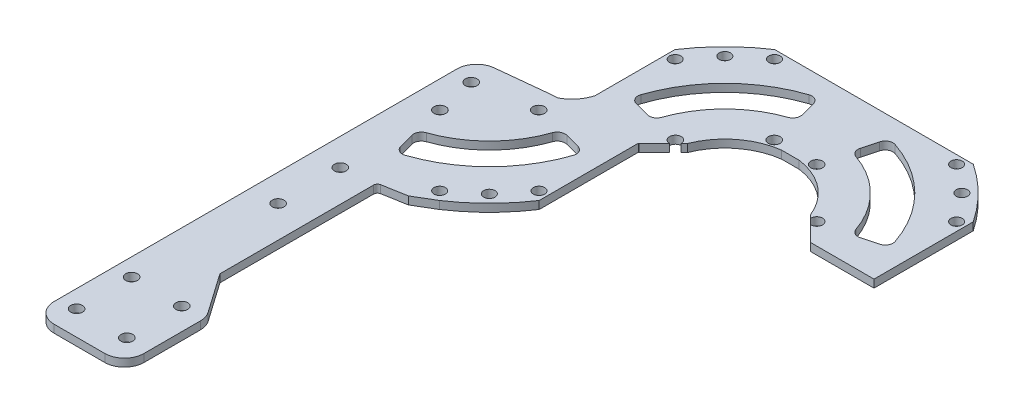
from build123d import *

# Parameters (mm, degrees)
SKETCH1_R           = 1.5
SKETCH1_R_2         = 1.45
BOSS_EXTRUDE1_DEPTH = 2
SKETCH_1_R          = 1.45
SKETCH_1_R_2        = 1.5
EXTRUDE_1_DEPTH     = 2
EXTRUDE_2_DEPTH     = 2
FILLET1_R           = 1


with BuildPart() as part:
    # Sketch1 → Boss-Extrude1 (new body)
    with BuildSketch(Plane(origin=(0, 0, 0), x_dir=(1, 0, 0), z_dir=(0, 1, 0))):
        with BuildLine():
            Line((-21.192961085, -132.078714637), (-21.192961085, -166.219718768))
            Line((-21.192961085, -166.219718768), (-14.185358568, -176.236618152))
            ThreePointArc((-14.185358568, -176.236618152), (-13.513427934, -177.60024794), (-13.282330236, -179.10276943))
            Line((-13.282330236, -179.10276943), (-13.282330236, -193.470906367))
            ThreePointArc((-13.282330236, -193.470906367), (-14.74679633, -197.006440273), (-18.282330236, -198.470906367))
            Line((-18.282330236, -198.470906367), (-21.77517331, -198.470906367))
            Line((-21.77517331, -198.470906367), (-31.192961085, -198.470906367))
            ThreePointArc((-31.192961085, -198.470906367), (-34.728494991, -197.006440273), (-36.192961085, -193.470906367))
            Line((-36.192961085, -193.470906367), (-36.192961085, -90.830339434))
            ThreePointArc((-36.192961085, -90.830339434), (-34.909297601, -87.485366654), (-31.717423925, -85.857921639))
            Line((-31.717423925, -85.857921639), (-19.324348326, -84.550769285))
            Line((-19.324348326, -84.550769285), (-12.49642386, -84.082177413))
            Line((-12.49642386, -84.082177413), (3.10357614, -84.082177413))
            Line((3.10357614, -84.082177413), (3.307038915, -84.078714637))
            Line((3.307038915, -84.078714637), (3.307038915, -109.367146032))
            ThreePointArc((3.307038915, -109.367146032), (-2.41677201, -116.354903712), (-9.40452969, -122.078714637))
            Line((-9.40452969, -122.078714637), (-14.349438262, -125.02189202))
            Line((-14.349438262, -125.02189202), (-21.192961085, -126.237284003))
            Line((-21.192961085, -126.237284003), (-21.192961085, -132.078714637))
        make_face()
        with Locations(Location((-18.919157596, -192.204354167, 0), (0, 0, 270))):
            Circle(SKETCH1_R, mode=Mode.SUBTRACT)
        with Locations(Location((-18.919157596, -178.204354167, 0), (0, 0, 270))):
            Circle(SKETCH1_R, mode=Mode.SUBTRACT)
        with Locations(Location((-31.717423925, -178.204354167, 0), (0, 0, 270))):
            Circle(SKETCH1_R, mode=Mode.SUBTRACT)
        with Locations(Location((-31.717423925, -192.204354167, 0), (0, 0, 270))):
            Circle(SKETCH1_R, mode=Mode.SUBTRACT)
        with Locations(Location((-29.287619577, -102.069022085, 0), (0, 0, 270))):
            Circle(SKETCH1_R, mode=Mode.SUBTRACT)
        with Locations(Location((-16.702653636, -89.484056145, 0), (0, 0, 270))):
            Circle(SKETCH1_R, mode=Mode.SUBTRACT)
        with Locations(Location((1.158345759, -107.272976806, 0), (0, 0, 270))):
            Circle(SKETCH1_R_2, mode=Mode.SUBTRACT)
        with Locations(Location((-4.499501528, -114.272174194, 0), (0, 0, 270))):
            Circle(SKETCH1_R_2, mode=Mode.SUBTRACT)
        with Locations(Location((-11.498698916, -119.930021481, 0), (0, 0, 270))):
            Circle(SKETCH1_R_2, mode=Mode.SUBTRACT)
        with Locations(Location((-29.287619577, -127.462503818, 0), (0, 0, 270))):
            Circle(SKETCH1_R, mode=Mode.SUBTRACT)
        with Locations(Location((-29.287619577, -143.302559608, 0), (0, 0, 270))):
            Circle(SKETCH1_R, mode=Mode.SUBTRACT)
        with Locations(Location((-31.442028499, -91.953708305, 0), (0, 0, 270))):
            Circle(SKETCH1_R, mode=Mode.SUBTRACT)
        with BuildLine():
            Line((-3.683855698, -92.504640443), (-7.556212498, -91.467045565))
            ThreePointArc((-7.556212498, -91.467045565), (-9.011313317, -91.632215687), (-9.963793597, -92.744591918))
            ThreePointArc((-9.963793597, -92.744591918), (-16.148276393, -102.623399329), (-26.027083804, -108.807882125))
            ThreePointArc((-26.027083804, -108.807882125), (-27.139460035, -109.760362404), (-27.304630157, -111.215463223))
            Line((-27.304630157, -111.215463223), (-26.267035279, -115.087820024))
            ThreePointArc((-26.267035279, -115.087820024), (-25.280541686, -116.332651264), (-23.697816809, -116.465904366))
            ThreePointArc((-23.697816809, -116.465904366), (-10.491422144, -108.280253578), (-2.305771356, -95.073858913))
            ThreePointArc((-2.305771356, -95.073858913), (-2.439024458, -93.491134036), (-3.683855698, -92.504640443))
        make_face(mode=Mode.SUBTRACT)
    extrude(amount=BOSS_EXTRUDE1_DEPTH)

    # 草图1 → 凸台-拉伸1 (add)
    with BuildSketch(Plane.XZ):
        with BuildLine():
            Line((-12.69642386, 84.082177413), (-12.69642386, 58.793746018))
            ThreePointArc((-12.69642386, 58.793746018), (-6.972612935, 51.805988338), (0.015144745, 46.082177413))
            Line((0.015144745, 46.082177413), (25.30357614, 46.082177413))
            Line((25.30357614, 46.082177413), (50.592007535, 46.082177413))
            ThreePointArc((50.592007535, 46.082177413), (57.579765215, 51.805988338), (63.30357614, 58.793746018))
            Line((63.30357614, 58.793746018), (63.30357614, 84.078714637))
            Line((63.30357614, 84.078714637), (47.168942899, 84.078714637))
            Line((47.168942899, 84.078714637), (43.263289357, 80.173061094))
            ThreePointArc((43.263289357, 80.173061094), (44.35454376, 77.612712957), (41.794195623, 78.70396736))
            Line((41.794195623, 78.70396736), (40.962688124, 77.872459862))
            ThreePointArc((40.962688124, 77.872459862), (37.21418877, 72.168102006), (31.509830915, 68.419602653))
            ThreePointArc((31.509830915, 68.419602653), (29.563736563, 67.782199069), (27.554675458, 67.385664037))
            Line((27.554675458, 67.385664037), (23.052476821, 67.389126813))
            ThreePointArc((23.052476821, 67.389126813), (21.043415716, 67.785661845), (19.097321364, 68.423065428))
            ThreePointArc((19.097321364, 68.423065428), (13.392963509, 72.171564782), (9.644464155, 77.875922638))
            Line((9.644464155, 77.875922638), (8.812956657, 78.707430136))
            ThreePointArc((8.812956657, 78.707430136), (6.25260852, 77.616175733), (7.343862923, 80.17652387))
            Line((7.343862923, 80.17652387), (3.43820938, 84.082177413))
            Line((3.43820938, 84.082177413), (-12.69642386, 84.082177413))
        make_face()
        with Locations(Location((61.154882984, 60.887915244, 0), (0, 0, 90))):
            Circle(SKETCH_1_R, mode=Mode.SUBTRACT)
        with Locations(Location((55.497035696, 53.888717856, 0), (0, 0, 90))):
            Circle(SKETCH_1_R, mode=Mode.SUBTRACT)
        with Locations(Location((48.497838309, 48.230870569, 0), (0, 0, 90))):
            Circle(SKETCH_1_R, mode=Mode.SUBTRACT)
        with Locations(Location((30.708917648, 66.091869964, 0), (0, 0, 90))):
            Circle(SKETCH_1_R_2, mode=Mode.SUBTRACT)
        with Locations(Location((2.109313971, 48.230870569, 0), (0, 0, 90))):
            Circle(SKETCH_1_R, mode=Mode.SUBTRACT)
        with Locations(Location((-4.889883417, 53.888717856, 0), (0, 0, 90))):
            Circle(SKETCH_1_R, mode=Mode.SUBTRACT)
        with Locations(Location((-10.547730705, 60.887915244, 0), (0, 0, 90))):
            Circle(SKETCH_1_R, mode=Mode.SUBTRACT)
        with Locations(Location((19.898234632, 66.091869964, 0), (0, 0, 90))):
            Circle(SKETCH_1_R_2, mode=Mode.SUBTRACT)
        with BuildLine():
            Line((52.440324726, 76.693846485), (56.312681527, 75.656251607))
            ThreePointArc((56.312681527, 75.656251607), (57.557512766, 74.669758014), (57.690765869, 73.087033137))
            ThreePointArc((57.690765869, 73.087033137), (49.505115081, 59.880638472), (36.298720415, 51.694987684))
            ThreePointArc((36.298720415, 51.694987684), (34.715995538, 51.828240786), (33.729501945, 53.073072026))
            Line((33.729501945, 53.073072026), (32.691907068, 56.945428827))
            ThreePointArc((32.691907068, 56.945428827), (32.857077189, 58.400529646), (33.96945342, 59.353009925))
            ThreePointArc((33.96945342, 59.353009925), (43.848260831, 65.537492721), (50.032743627, 75.416300132))
            ThreePointArc((50.032743627, 75.416300132), (50.985223907, 76.528676363), (52.440324726, 76.693846485))
        make_face(mode=Mode.SUBTRACT)
        with BuildLine():
            Line((17.915245212, 56.945428827), (16.877650334, 53.073072026))
            ThreePointArc((16.877650334, 53.073072026), (15.891156741, 51.828240786), (14.308431864, 51.694987684))
            ThreePointArc((14.308431864, 51.694987684), (1.102037199, 59.880638472), (-7.083613589, 73.087033137))
            ThreePointArc((-7.083613589, 73.087033137), (-6.950360487, 74.669758014), (-5.705529247, 75.656251607))
            Line((-5.705529247, 75.656251607), (-1.833172447, 76.693846485))
            ThreePointArc((-1.833172447, 76.693846485), (-0.378071628, 76.528676363), (0.574408652, 75.416300132))
            ThreePointArc((0.574408652, 75.416300132), (6.758891448, 65.537492721), (16.637698859, 59.353009925))
            ThreePointArc((16.637698859, 59.353009925), (17.75007509, 58.400529646), (17.915245212, 56.945428827))
        make_face(mode=Mode.SUBTRACT)
    extrude(amount=-EXTRUDE_1_DEPTH)

    # 草图2 → 凸台-拉伸2 (add)
    with BuildSketch(Plane.XZ):
        with BuildLine():
            Line((-12.443677961, 84.250317512), (-17.409343258, 84.591104879))
            ThreePointArc((-17.409343258, 84.591104879), (-14.024568956, 81.869997058), (-12.443677961, 77.825011457))
            Line((-12.443677961, 77.825011457), (-12.443677961, 84.250317512))
        make_face()
    extrude(amount=-EXTRUDE_2_DEPTH)

    # Fillet1
    fillet1_edges = [part.edges().sort_by_distance(p)[0] for p in [
        (-21.192961085, 1, 126.237284003),
    ]]
    fillet(fillet1_edges, radius=FILLET1_R)


solid = part.part
